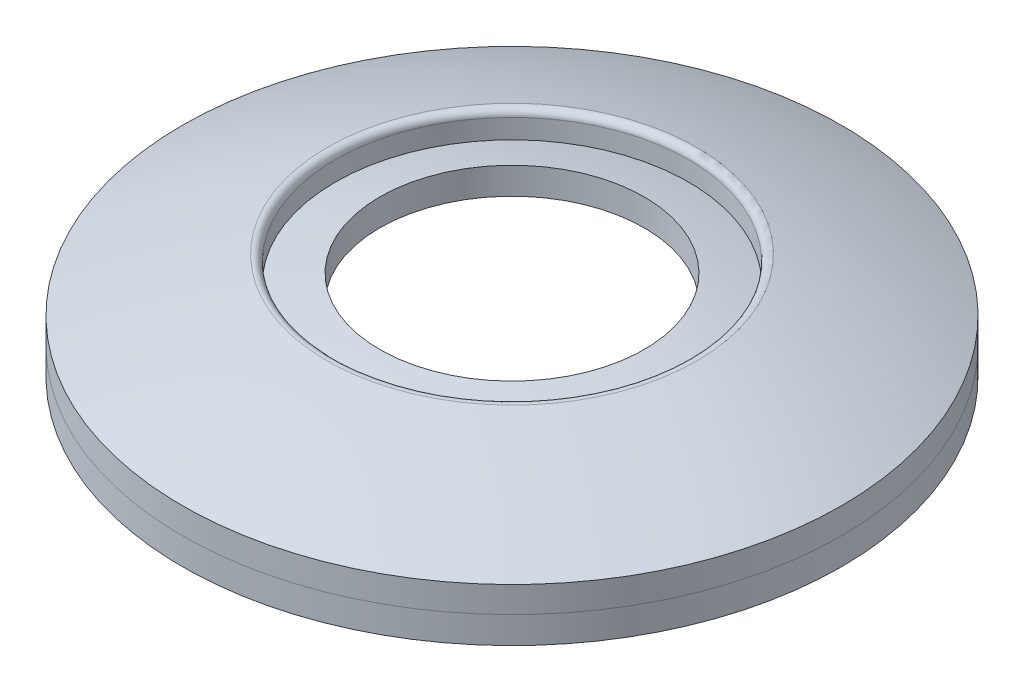
from build123d import *


with BuildPart() as part:
    # Sketch6 → Revolve3 (revolve)
    with BuildSketch(Plane.XY, mode=Mode.PRIVATE) as revolve3_sk:
        with BuildLine():
            Line((-10.287, -0.00635), (-10.287, -0.81915))
            Line((-10.287, -0.81915), (-10.154696366, -0.81915))
            ThreePointArc((-10.154696366, -0.81915), (-7.877293413, 0.135617256), (-5.5118, 0.84455))
            Line((-5.5118, 0.84455), (-5.5118, 1.45161))
            ThreePointArc((-5.5118, 1.45161), (-5.592392955, 1.614910841), (-5.771031697, 1.650274506))
            ThreePointArc((-5.771031697, 1.650274506), (-8.065724276, 0.922029647), (-10.287, -0.00635))
        make_face()
    revolve(revolve3_sk.sketch.rotate(Axis((0, -1.65735, 0), (0, 1, 0)), 180), axis=Axis((0, -1.65735, 0), (0, 1, 0)))


with BuildPart() as body_2:
    # Sketch7 → Revolve4 (revolve)
    with BuildSketch(Plane.XY):
        with BuildLine():
            Line((-10.287, -0.81915), (-10.287, -1.65735))
            Line((-10.287, -1.65735), (-9.991951576, -1.65735))
            ThreePointArc((-9.991951576, -1.65735), (-7.127134835, -0.477310553), (-4.1275, 0.298485114))
            Line((-4.1275, 0.298485114), (-4.1275, 1.136685114))
            ThreePointArc((-4.1275, 1.136685114), (-7.20774625, 0.364153474), (-10.154696366, -0.81915))
            Line((-10.154696366, -0.81915), (-10.287, -0.81915))
        make_face()
    revolve(axis=Axis((0, -1.65735, 0), (0, 1, 0)))


solid = Compound([part.part, body_2.part])
